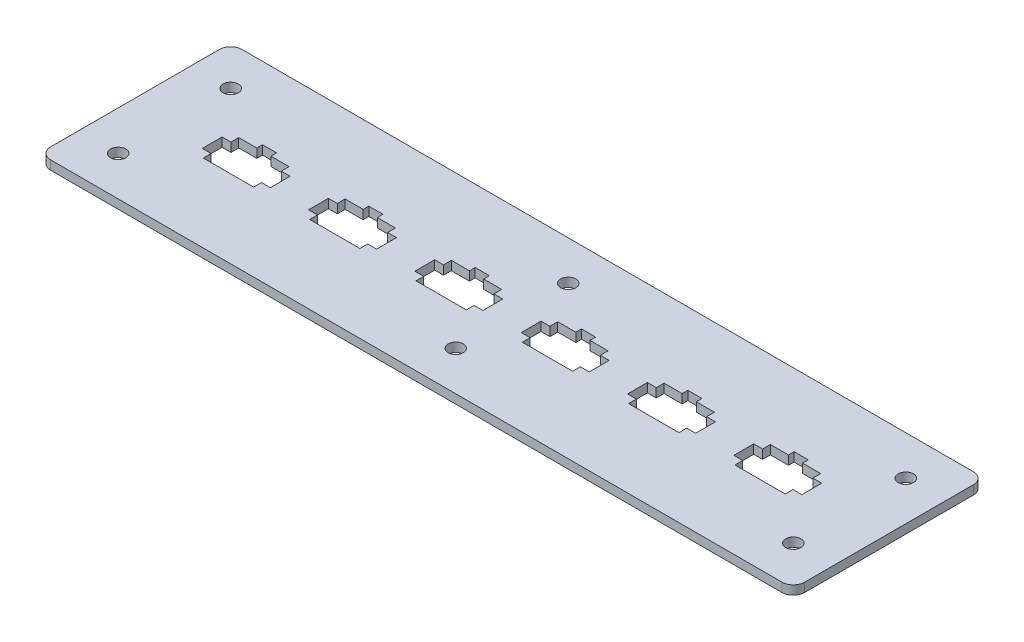
from build123d import *

# Parameters (mm, degrees)
SKETCH1_R           = 2.15265
BOSS_EXTRUDE1_DEPTH = 2.54


with BuildPart() as part:
    # Sketch1 → Boss-Extrude1 (new body)
    with BuildSketch(Plane(origin=(0, 0, 0), x_dir=(1, 0, 0), z_dir=(0, 1, 0))):
        with BuildLine():
            Line((178.1875, 29.7875), (-28.1875, 29.7875))
            ThreePointArc((-28.1875, 29.7875), (-30.43256403, 28.85756403), (-31.3625, 26.6125))
            Line((-31.3625, 26.6125), (-31.3625, -21.0125))
            ThreePointArc((-31.3625, -21.0125), (-30.43256403, -23.25756403), (-28.1875, -24.1875))
            Line((-28.1875, -24.1875), (178.1875, -24.1875))
            ThreePointArc((178.1875, -24.1875), (180.43256403, -23.25756403), (181.3625, -21.0125))
            Line((181.3625, -21.0125), (181.3625, 26.6125))
            ThreePointArc((181.3625, 26.6125), (180.43256403, 28.85756403), (178.1875, 29.7875))
        make_face()
        with Locations((-20.25, -13.075)):
            Circle(SKETCH1_R, mode=Mode.SUBTRACT)
        with Locations((75, -13.075)):
            Circle(SKETCH1_R, mode=Mode.SUBTRACT)
        with Locations((170.25, -13.075)):
            Circle(SKETCH1_R, mode=Mode.SUBTRACT)
        Polygon((-1.999996, 7.8), (-1.999996, 9.4), (1.999996, 9.4), (1.999996, 7.8), (7.1, 7.8), (7.1, 5.6), (9.6, 5.6), (9.6, 0), (7.1, 0), (7.1, -2.2), (-7.1, -2.2), (-7.1, 0), (-9.6, 0), (-9.6, 5.6), (-7.1, 5.6), (-7.1, 7.8), align=None, mode=Mode.SUBTRACT)
        Polygon((28.000004, 7.8), (28.000004, 9.4), (31.999996, 9.4), (31.999996, 7.8), (37.1, 7.8), (37.1, 5.6), (39.6, 5.6), (39.6, 0), (37.1, 0), (37.1, -2.2), (22.9, -2.2), (22.9, 0), (20.4, 0), (20.4, 5.6), (22.9, 5.6), (22.9, 7.8), align=None, mode=Mode.SUBTRACT)
        Polygon((58.000004, 7.8), (58.000004, 9.4), (61.999996, 9.4), (61.999996, 7.8), (67.1, 7.8), (67.1, 5.6), (69.6, 5.6), (69.6, 0), (67.1, 0), (67.1, -2.2), (52.9, -2.2), (52.9, 0), (50.4, 0), (50.4, 5.6), (52.9, 5.6), (52.9, 7.8), align=None, mode=Mode.SUBTRACT)
        with Locations((-20.25, 18.675)):
            Circle(SKETCH1_R, mode=Mode.SUBTRACT)
        Polygon((88.000004, 7.8), (88.000004, 9.4), (91.999996, 9.4), (91.999996, 7.8), (97.1, 7.8), (97.1, 5.6), (99.6, 5.6), (99.6, 0), (97.1, 0), (97.1, -2.2), (82.9, -2.2), (82.9, 0), (80.4, 0), (80.4, 5.6), (82.9, 5.6), (82.9, 7.8), align=None, mode=Mode.SUBTRACT)
        Polygon((118.000004, 7.8), (118.000004, 9.4), (121.999996, 9.4), (121.999996, 7.8), (127.1, 7.8), (127.1, 5.6), (129.6, 5.6), (129.6, 0), (127.1, 0), (127.1, -2.2), (112.9, -2.2), (112.9, 0), (110.4, 0), (110.4, 5.6), (112.9, 5.6), (112.9, 7.8), align=None, mode=Mode.SUBTRACT)
        Polygon((148.000004, 7.8), (148.000004, 9.4), (151.999996, 9.4), (151.999996, 7.8), (157.1, 7.8), (157.1, 5.6), (159.6, 5.6), (159.6, 0), (157.1, 0), (157.1, -2.2), (142.9, -2.2), (142.9, 0), (140.4, 0), (140.4, 5.6), (142.9, 5.6), (142.9, 7.8), align=None, mode=Mode.SUBTRACT)
        with Locations((75, 18.675)):
            Circle(SKETCH1_R, mode=Mode.SUBTRACT)
        with Locations((170.25, 18.675)):
            Circle(SKETCH1_R, mode=Mode.SUBTRACT)
    extrude(amount=BOSS_EXTRUDE1_DEPTH)


solid = part.part
